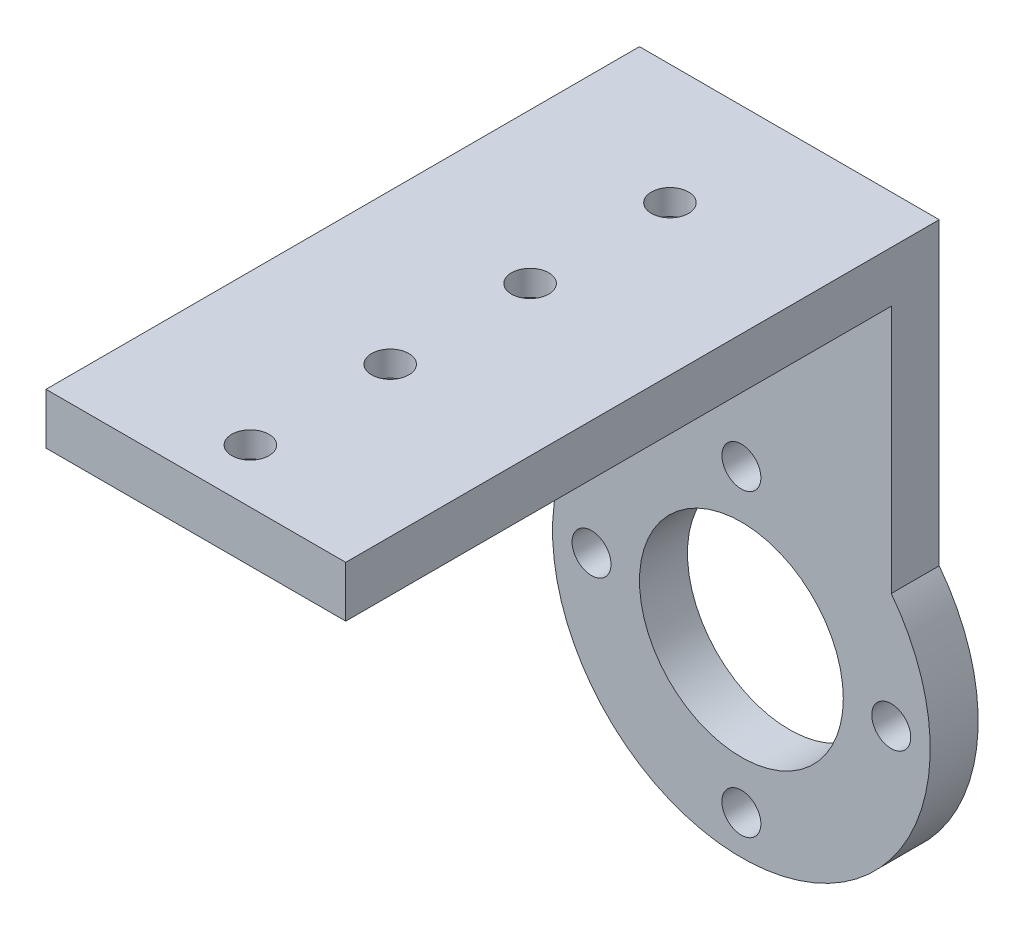
from build123d import *

# Parameters (mm, degrees)
SKETCH_1_R          = 31.5
EXTRUDE_1_DEPTH     = 8
SKETCH_1_3_R        = 3.25
CUT_EXTRUDE_1_DEPTH = 8
SKETCH_1_4_R        = 17
CUT_EXTRUDE_2_DEPTH = 6
EXTRUDE_2_DEPTH     = 4
SKETCH_4_W          = 50
SKETCH_4_H          = 8.5
EXTRUDE_3_DEPTH     = 95
SKETCH_5_R          = 3.1
CUT_EXTRUDE_3_DEPTH = 10
SKETCH_5_3_R        = 6.75
SKETCH_5_3_R_2      = 3.1
CUT_EXTRUDE_4_DEPTH = 4.3
EXTRUDE_4_DEPTH     = 8
SKETCH_1_8_R        = 17
CUT_EXTRUDE_5_DEPTH = 8


with BuildPart() as part:
    # 草图1 → 凸台-拉伸1 (new body)
    with BuildSketch(Plane.XY):
        Circle(SKETCH_1_R)
    extrude(amount=EXTRUDE_1_DEPTH)

    # 草图1<3> → 切除-拉伸1 (cut)
    with BuildSketch(Plane.XY):
        with Locations((0, 25)):
            Circle(SKETCH_1_3_R)
        with Locations((-25, 0)):
            Circle(SKETCH_1_3_R)
        with Locations((25, 0)):
            Circle(SKETCH_1_3_R)
        with Locations((0, -25)):
            Circle(SKETCH_1_3_R)
    extrude(amount=CUT_EXTRUDE_1_DEPTH, mode=Mode.SUBTRACT)

    # 草图1<4> → 切除-拉伸2 (cut)
    with BuildSketch(Plane.XY):
        Circle(SKETCH_1_4_R)
    extrude(amount=CUT_EXTRUDE_2_DEPTH, mode=Mode.SUBTRACT)

    # 草图1<5> → 凸台-拉伸2 (add)
    with BuildSketch(Plane.XY):
        with BuildLine():
            Line((25, 69.163767897), (17.863752341, 69.163767897))
            Line((17.863752341, 69.163767897), (-25, 69.163767897))
            Line((-25, 69.163767897), (-25, 28.735067362))
            Line((-25, 28.735067362), (-25, 19.163767897))
            ThreePointArc((-25, 19.163767897), (0, 31.5), (25, 19.163767897))
            Line((25, 19.163767897), (25, 69.163767897))
        make_face()
    extrude(amount=EXTRUDE_2_DEPTH)

    # 草图4 → 凸台-拉伸3 (add)
    with BuildSketch(Plane.XY.offset(4)):
        with Locations((0, 64.913767897)):
            Rectangle(SKETCH_4_W, SKETCH_4_H)
    extrude(amount=EXTRUDE_3_DEPTH)

    # 草图5 → 切除-拉伸3 (cut)
    with BuildSketch(Plane.XZ.offset(-60.663767897)):
        with Locations((0.088398714, 90)):
            Circle(SKETCH_5_R)
        with Locations((0.088398714, 20)):
            Circle(SKETCH_5_R)
        with Locations((0.088398714, 43.333)):
            Circle(SKETCH_5_R)
        with Locations((0.088398714, 66.66667)):
            Circle(SKETCH_5_R)
    extrude(amount=-CUT_EXTRUDE_3_DEPTH, mode=Mode.SUBTRACT)

    # 草图5<3> → 切除-拉伸4 (cut)
    # profile 1 of 4: a face of its own
    with BuildSketch(Plane.XZ.offset(-60.663767897)):
        with Locations((0.088398714, 90)):
            Circle(SKETCH_5_3_R)
    # profile 2 of 4: a face of its own
    with BuildSketch(Plane.XZ.offset(-60.663767897)):
        with Locations((0.088398714, 20)):
            Circle(SKETCH_5_3_R)
        with Locations((0.088398714, 20)):
            Circle(SKETCH_5_3_R_2, mode=Mode.SUBTRACT)
    # profile 3 of 4: a face of its own
    with BuildSketch(Plane.XZ.offset(-60.663767897)):
        with Locations((0.088398714, 43.333)):
            Circle(SKETCH_5_3_R)
        with Locations((0.088398714, 43.333)):
            Circle(SKETCH_5_3_R_2, mode=Mode.SUBTRACT)
    # profile 4 of 4: a face of its own
    with BuildSketch(Plane.XZ.offset(-60.663767897)):
        with Locations((0.088398714, 66.66667)):
            Circle(SKETCH_5_3_R)
        with Locations((0.088398714, 66.66667)):
            Circle(SKETCH_5_3_R_2, mode=Mode.SUBTRACT)
    extrude(amount=-CUT_EXTRUDE_4_DEPTH, mode=Mode.SUBTRACT)

    # 草图1<7> → 凸台-拉伸4 (add)
    with BuildSketch(Plane.XY):
        with BuildLine():
            Line((25, 69.163767897), (17.863752341, 69.163767897))
            Line((17.863752341, 69.163767897), (-25, 69.163767897))
            Line((-25, 69.163767897), (-25, 28.735067362))
            Line((-25, 28.735067362), (-25, 19.163767897))
            ThreePointArc((-25, 19.163767897), (0, 31.5), (25, 19.163767897))
            Line((25, 19.163767897), (25, 69.163767897))
        make_face()
    extrude(amount=EXTRUDE_4_DEPTH)

    # 草图1<8> → 切除-拉伸5 (cut)
    with BuildSketch(Plane.XY):
        Circle(SKETCH_1_8_R)
    extrude(amount=CUT_EXTRUDE_5_DEPTH, mode=Mode.SUBTRACT)


solid = part.part
